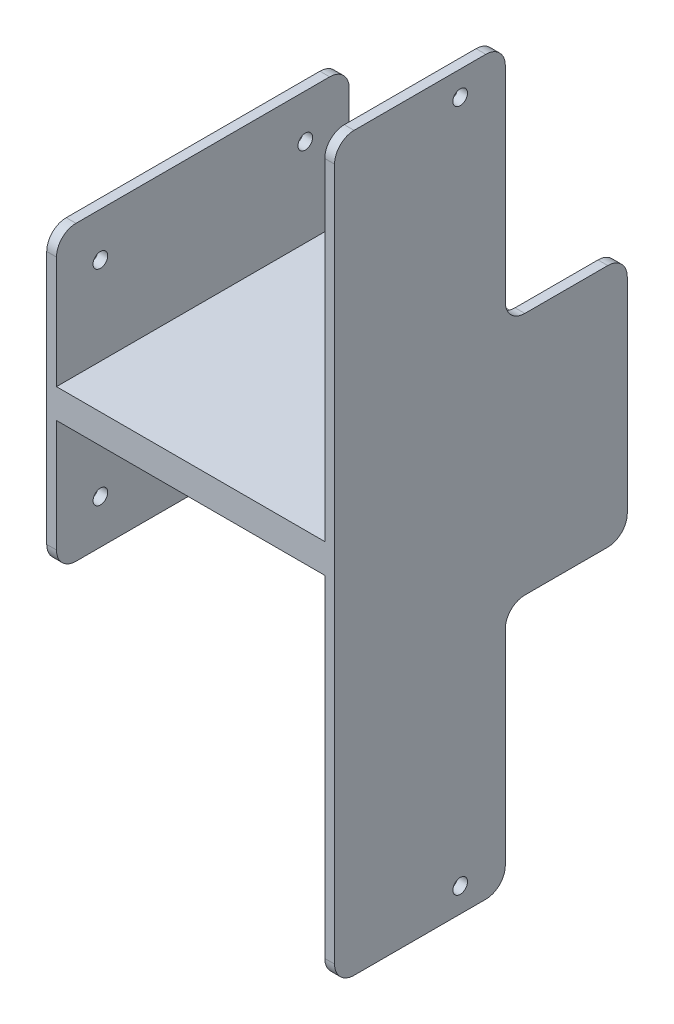
from build123d import *

# Parameters (mm, degrees)
EXTRUDE_2_DEPTH     = 60
SKETCH_3_R          = 1.5
CUT_EXTRUDE_1_DEPTH = 40
SKETCH_7_W          = 35
SKETCH_7_H          = 50
EXTRUDE_4_DEPTH     = 2
SKETCH_8_R          = 1.5
CUT_EXTRUDE_3_DEPTH = 12
FILLET_1_R          = 4


with BuildPart() as part:
    # 草图1 → 凸台-拉伸2 (new body)
    with BuildSketch(Plane.XY):
        Polygon((-29.5, 30), (-27.5, 30), (-27.5, 3), (27.5, 3), (27.5, 25), (29.5, 25), (29.5, -25), (27.5, -25), (27.5, -3), (-27.5, -3), (-27.5, -30), (-29.5, -30), align=None)
    extrude(amount=EXTRUDE_2_DEPTH)

    # 草图3 → 切除-拉伸1 (cut)
    with BuildSketch(Plane.ZY.offset(29.5)):
        with Locations(Location((51, 21, 0), (0, 0, 270))):
            Circle(SKETCH_3_R)
        with Locations(Location((51, -21, 0), (0, 0, 270))):
            Circle(SKETCH_3_R)
        with Locations(Location((9, 21, 0), (0, 0, 270))):
            Circle(SKETCH_3_R)
        with Locations(Location((9, -21, 0), (0, 0, 270))):
            Circle(SKETCH_3_R)
    extrude(amount=-CUT_EXTRUDE_1_DEPTH, mode=Mode.SUBTRACT)

    # 草图7 → 凸台-拉伸4 (add)
    with BuildSketch(Plane.ZY.offset(-27.5)):
        with Locations((42.5, 50)):
            Rectangle(SKETCH_7_W, SKETCH_7_H)
        with Locations((42.5, -50)):
            Rectangle(SKETCH_7_W, SKETCH_7_H)
    extrude(amount=-EXTRUDE_4_DEPTH)

    # 草图8 → 切除-拉伸3 (cut)
    with BuildSketch(Plane.ZY.offset(-27.5)):
        with Locations(Location((34.25, 70, 0), (0, 0, 270))):
            Circle(SKETCH_8_R)
        with Locations(Location((34.25, -70, 0), (0, 0, 270))):
            Circle(SKETCH_8_R)
    extrude(amount=-CUT_EXTRUDE_3_DEPTH, mode=Mode.SUBTRACT)

    # 圆角1
    fillet_1_edges = [part.edges().sort_by_distance(p)[0] for p in [
        (-28.5, 30, 0),
        (28.5, 25, 0),
        (28.5, -25, 0),
        (-28.5, -30, 0),
        (-28.5, 30, 60),
        (28.5, 25, 25),
        (28.5, 75, 25),
        (28.5, 75, 60),
        (28.5, -25, 25),
        (28.5, -75, 60),
        (28.5, -75, 25),
        (-28.5, -30, 60),
    ]]
    fillet(fillet_1_edges, radius=FILLET_1_R)


solid = part.part
